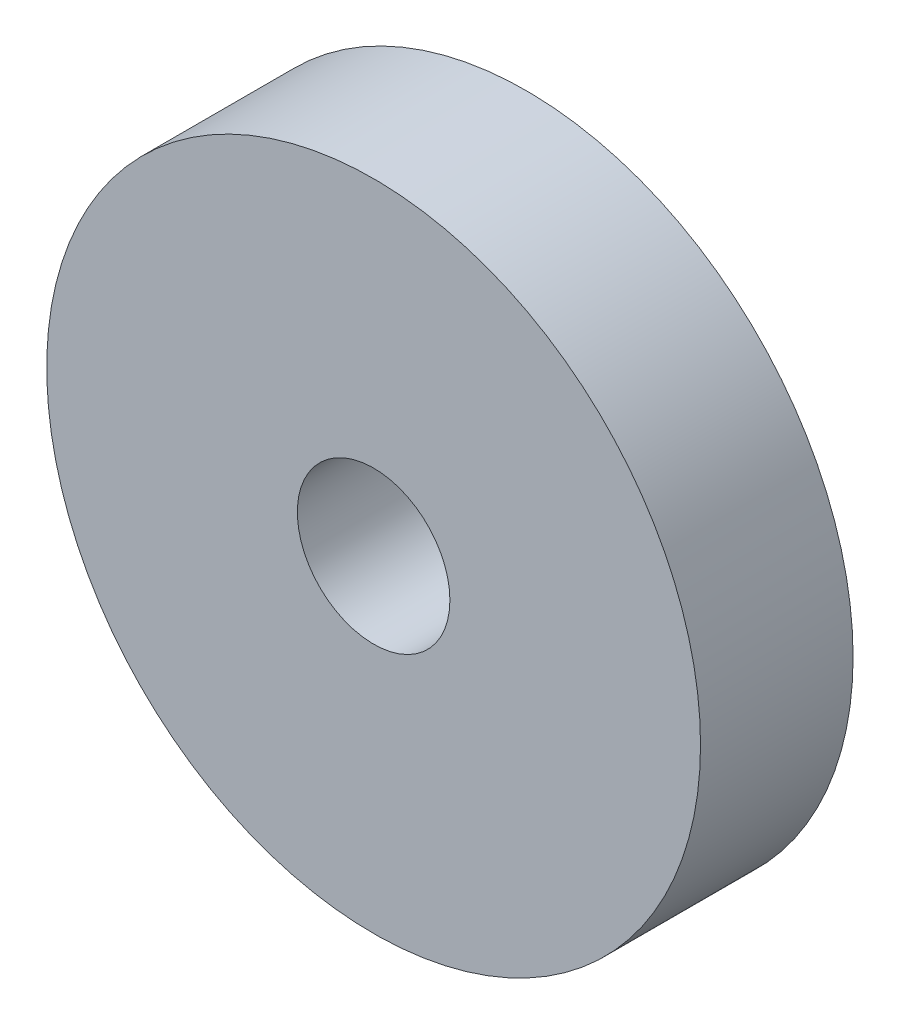
from build123d import *

# Parameters (mm, degrees)
SKETCH1_R           = 3.81
SKETCH1_R_2         = 0.889
BOSS_EXTRUDE1_DEPTH = 1.778


with BuildPart() as part:
    # Sketch1 → Boss-Extrude1 (new body)
    with BuildSketch(Plane.XY):
        Circle(SKETCH1_R)
        Circle(SKETCH1_R_2, mode=Mode.SUBTRACT)
    extrude(amount=BOSS_EXTRUDE1_DEPTH)


solid = part.part
